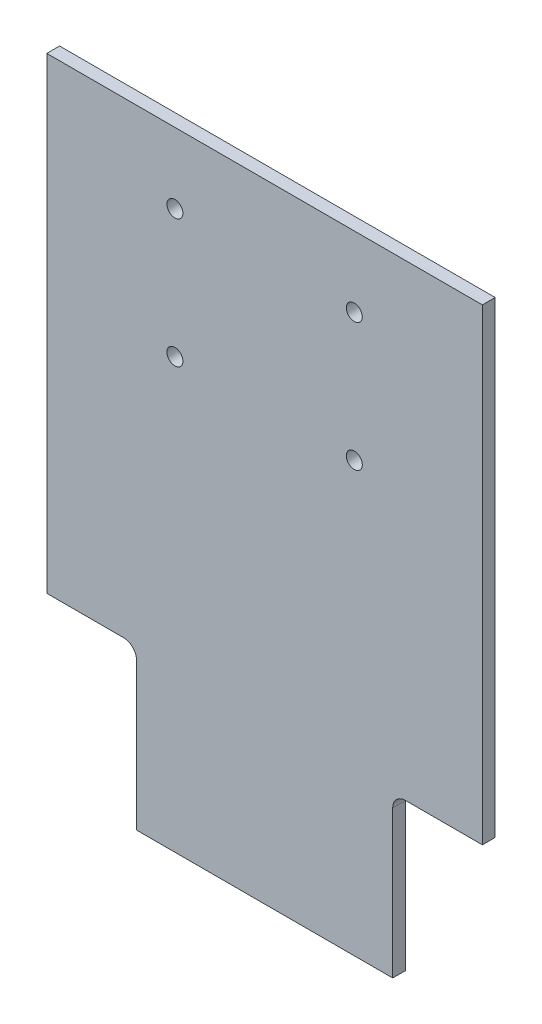
from build123d import *

# Parameters (mm, degrees)
SKETCH_1_W          = 68
SKETCH_1_H          = 58
SKETCH_1_R          = 1.25
EXTRUDE_1_DEPTH     = 2
SKETCH_2_W          = 2
SKETCH_2_H          = 40
EXTRUDE_2_DEPTH     = 68
SKETCH_3_W          = 14
SKETCH_3_H          = 25
CUT_EXTRUDE_1_DEPTH = 10
FILLET_1_R          = 2


with BuildPart() as part:
    # 草图1 → 凸台-拉伸1 (new body)
    with BuildSketch(Plane.XY):
        with Locations((34, 29)):
            Rectangle(SKETCH_1_W, SKETCH_1_H)
        with Locations((48, 27)):
            Circle(SKETCH_1_R, mode=Mode.SUBTRACT)
        with Locations(Location((20, 27, 0), (0, 0, 180))):
            Circle(SKETCH_1_R, mode=Mode.SUBTRACT)
        with Locations((48, 47)):
            Circle(SKETCH_1_R, mode=Mode.SUBTRACT)
        with Locations(Location((20, 47, 0), (0, 0, 180))):
            Circle(SKETCH_1_R, mode=Mode.SUBTRACT)
    extrude(amount=EXTRUDE_1_DEPTH)

    # 草图2 → 凸台-拉伸2 (add)
    with BuildSketch(Plane(origin=(68, 0, 0), x_dir=(0, 0, -1), z_dir=(1, 0, 0))):
        with Locations((-1, -20)):
            Rectangle(SKETCH_2_W, SKETCH_2_H)
    extrude(amount=-EXTRUDE_2_DEPTH)

    # 草图3 → 切除-拉伸1 (cut)
    with BuildSketch(Plane.XY.offset(2)):
        with Locations((61, -27.5)):
            Rectangle(SKETCH_3_W, SKETCH_3_H)
        with Locations((7, -27.5)):
            Rectangle(SKETCH_3_W, SKETCH_3_H)
    extrude(amount=-CUT_EXTRUDE_1_DEPTH, mode=Mode.SUBTRACT)

    # 圆角1
    fillet_1_edges = [part.edges().sort_by_distance(p)[0] for p in [
        (54, -15, 1),
        (14, -15, 1),
    ]]
    fillet(fillet_1_edges, radius=FILLET_1_R)


solid = part.part
